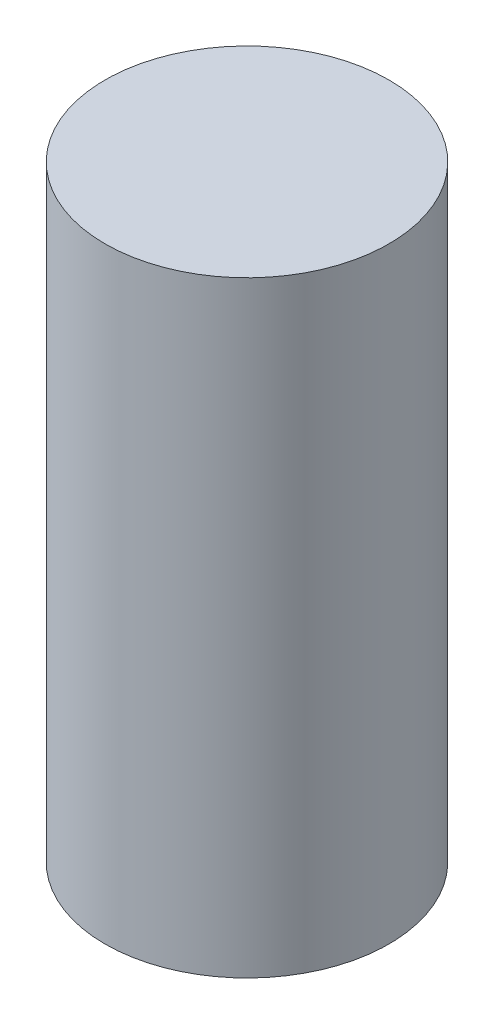
from build123d import *

# Parameters (mm, degrees)
SKETCH1_R           = 13.378334101
BOSS_EXTRUDE1_DEPTH = 57.14365


with BuildPart() as part:
    # Sketch1 → Boss-Extrude1 (new body)
    with BuildSketch(Plane(origin=(0, 0, 0), x_dir=(1, 0, 0), z_dir=(0, 1, 0))):
        with Locations(Location((138.316716, -27.935682, 0), (0, 0, 270))):
            Circle(SKETCH1_R)
    extrude(amount=BOSS_EXTRUDE1_DEPTH)


solid = part.part
